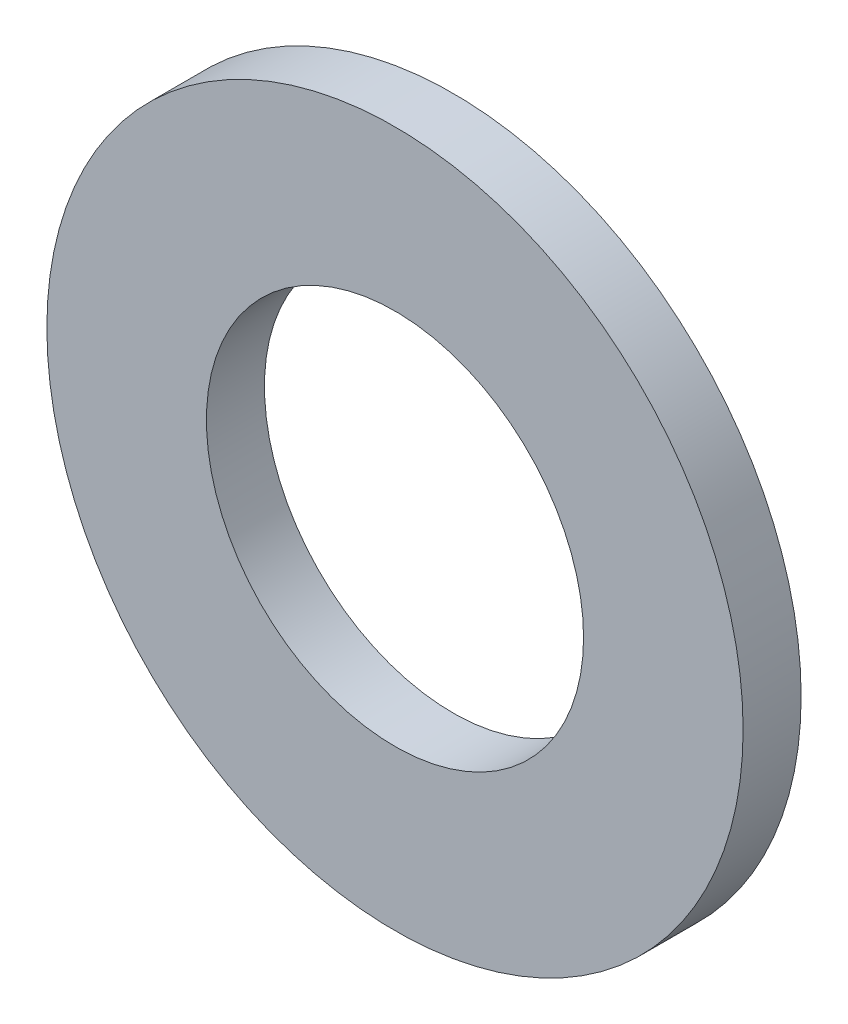
from build123d import *

# Parameters (mm, degrees)
SKETCH1_R           = 6
SKETCH1_R_2         = 3.25
BOSS_EXTRUDE1_DEPTH = 1


with BuildPart() as part:
    # Sketch1 → Boss-Extrude1 (new body)
    with BuildSketch(Plane.XY):
        Circle(SKETCH1_R)
        Circle(SKETCH1_R_2, mode=Mode.SUBTRACT)
    extrude(amount=BOSS_EXTRUDE1_DEPTH)


solid = part.part
